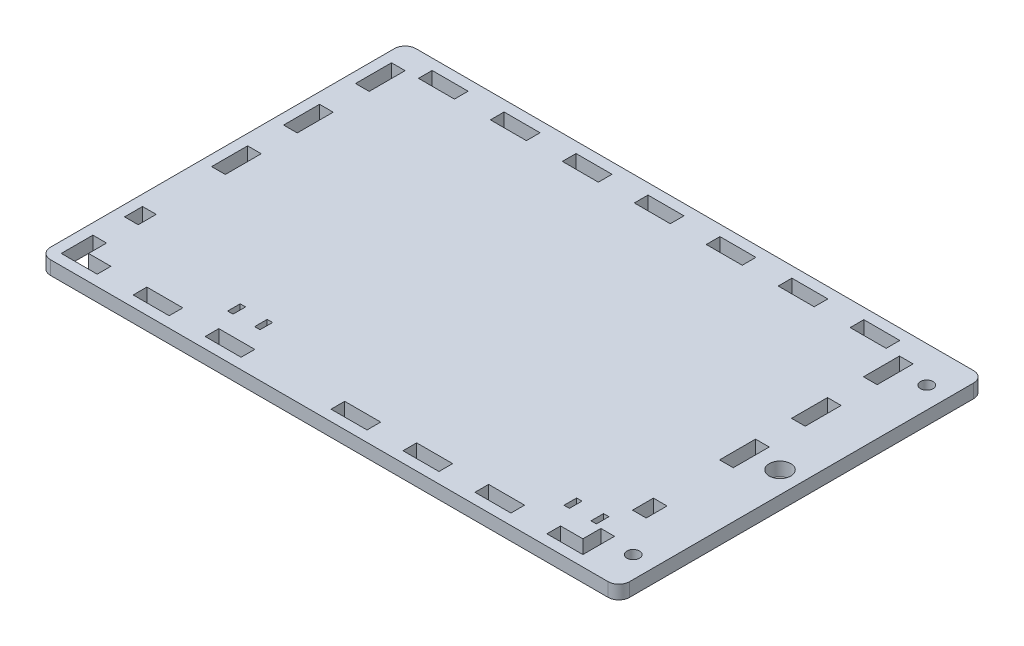
from build123d import *

# Parameters (mm, degrees)
SKETCH1_W           = 151
SKETCH1_H           = 101.6
BOSS_EXTRUDE1_DEPTH = 3.8
SKETCH3_W           = 1.5
SKETCH3_H           = 3.5
CUT_EXTRUDE1_DEPTH  = 183.038457475
SKETCH4_W           = 10
SKETCH4_H           = 101.6
BOSS_EXTRUDE2_DEPTH = 3.8
SKETCH5_R           = 3
SKETCH5_R_2         = 1.75
CUT_EXTRUDE2_DEPTH  = 191.415335517
FILLET1_R           = 3
FILLET2_R           = 3
SKETCH6_W           = 3.8
SKETCH6_H           = 5.8
SKETCH6_H_2         = 10
SKETCH6_W_2         = 10
SKETCH6_H_3         = 3.8
SKETCH6_H_4         = 5
CUT_EXTRUDE3_DEPTH  = 191.415335517


with BuildPart() as part:
    # Sketch1 → Boss-Extrude1 (new body)
    with BuildSketch(Plane(origin=(0, 0, 0), x_dir=(1, 0, 0), z_dir=(0, 1, 0))):
        with Locations((75.5, -50.8)):
            Rectangle(SKETCH1_W, SKETCH1_H)
    extrude(amount=BOSS_EXTRUDE1_DEPTH)

    # Sketch3 → Cut-Extrude1 (cut, through all)
    with BuildSketch(Plane.XZ):
        with Locations((40.75, 87.6)):
            Rectangle(SKETCH3_W, SKETCH3_H)
        with Locations((48.25, 87.6)):
            Rectangle(SKETCH3_W, SKETCH3_H)
        with Locations((134.25, 87.6)):
            Rectangle(SKETCH3_W, SKETCH3_H)
        with Locations((141.75, 87.6)):
            Rectangle(SKETCH3_W, SKETCH3_H)
    extrude(amount=-CUT_EXTRUDE1_DEPTH, mode=Mode.SUBTRACT)

    # Sketch4 → Boss-Extrude2 (add, through all)
    with BuildSketch(Plane.XZ):
        with Locations((156, 50.8)):
            Rectangle(SKETCH4_W, SKETCH4_H)
    extrude(amount=-BOSS_EXTRUDE2_DEPTH)

    # Sketch5 → Cut-Extrude2 (cut, through all)
    with BuildSketch(Plane.XZ):
        with Locations(Location((155, 50.8, 0), (0, 0, 270))):
            Circle(SKETCH5_R)
        with Locations(Location((155, 91.6, 0), (0, 0, 270))):
            Circle(SKETCH5_R_2)
        with Locations(Location((155, 10, 0), (0, 0, 270))):
            Circle(SKETCH5_R_2)
    extrude(amount=-CUT_EXTRUDE2_DEPTH, mode=Mode.SUBTRACT)

    # Fillet1
    fillet1_edges = [part.edges().sort_by_distance(p)[0] for p in [
        (0, 1.9, 0),
        (0, 1.9, 101.6),
    ]]
    fillet(fillet1_edges, radius=FILLET1_R)

    # Fillet2
    fillet2_edges = [part.edges().sort_by_distance(p)[0] for p in [
        (161, 1.9, 101.6),
        (161, 1.9, 0),
    ]]
    fillet(fillet2_edges, radius=FILLET2_R)

    # Sketch6 → Cut-Extrude3 (cut, through all)
    with BuildSketch(Plane(origin=(0, 3.8, 0), x_dir=(1, 0, 0), z_dir=(0, 1, 0))):
        Polygon((148, -94), (148, -89.8), (144.2, -89.8), (144.2, -94.8), (138, -94.8), (138, -98.6), (148, -98.6), align=None)
        with Locations((146.1, -78.1)):
            Rectangle(SKETCH6_W, SKETCH6_H)
        with Locations((146.1, -51.8)):
            Rectangle(SKETCH6_W, SKETCH6_H_2)
        with Locations((146.1, -31.8)):
            Rectangle(SKETCH6_W, SKETCH6_H_2)
        with Locations((146.1, -11.8)):
            Rectangle(SKETCH6_W, SKETCH6_H_2)
        with Locations((135.5, -4.9)):
            Rectangle(SKETCH6_W_2, SKETCH6_H_3)
        with Locations((115.5, -4.9)):
            Rectangle(SKETCH6_W_2, SKETCH6_H_3)
        with Locations((95.5, -4.9)):
            Rectangle(SKETCH6_W_2, SKETCH6_H_3)
        with Locations((75.5, -4.9)):
            Rectangle(SKETCH6_W_2, SKETCH6_H_3)
        with Locations((55.5, -4.9)):
            Rectangle(SKETCH6_W_2, SKETCH6_H_3)
        with Locations((35.5, -4.9)):
            Rectangle(SKETCH6_W_2, SKETCH6_H_3)
        with Locations((15.5, -4.9)):
            Rectangle(SKETCH6_W_2, SKETCH6_H_3)
        with Locations((4.9, -11.8)):
            Rectangle(SKETCH6_W, SKETCH6_H_2)
        with Locations((4.9, -31.8)):
            Rectangle(SKETCH6_W, SKETCH6_H_2)
        with Locations((4.9, -51.8)):
            Rectangle(SKETCH6_W, SKETCH6_H_2)
        with Locations((4.9, -78.5)):
            Rectangle(SKETCH6_W, SKETCH6_H_4)
        Polygon((6.8, -94.8), (6.8, -89.8), (3, -89.8), (3, -94), (3, -98.6), (13, -98.6), (13, -94.8), align=None)
        with Locations((28, -96.7)):
            Rectangle(SKETCH6_W_2, SKETCH6_H_3)
        with Locations((48, -96.7)):
            Rectangle(SKETCH6_W_2, SKETCH6_H_3)
        with Locations((83, -96.7)):
            Rectangle(SKETCH6_W_2, SKETCH6_H_3)
        with Locations((103, -96.7)):
            Rectangle(SKETCH6_W_2, SKETCH6_H_3)
        with Locations((123, -96.7)):
            Rectangle(SKETCH6_W_2, SKETCH6_H_3)
    extrude(amount=-CUT_EXTRUDE3_DEPTH, mode=Mode.SUBTRACT)


solid = part.part
